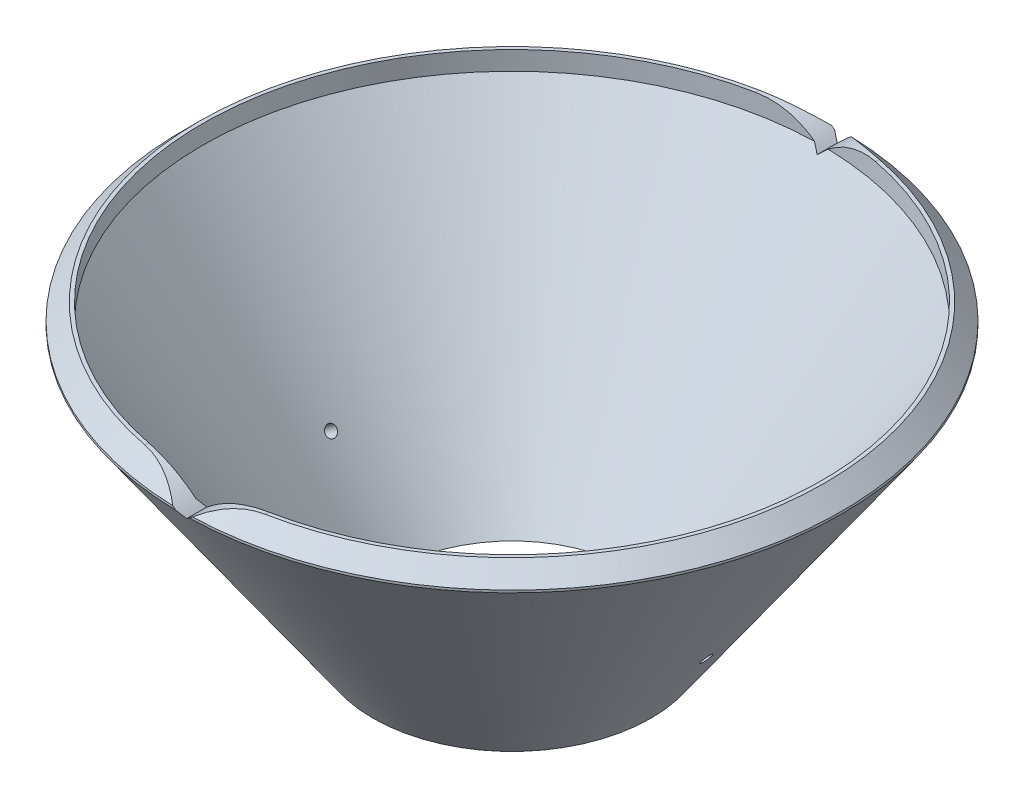
from build123d import *

# Parameters (mm, degrees)
SKETCH36_R              = 0.6
SIDE_HOLES_DEPTH        = 2
CIRPATTERN2_COUNT       = 2
SKETCH37_R              = 35
SKETCH37_R_2            = 32.86364447
BOSS_EXTRUDE1_DEPTH     = 2
CHAMFER2_SIZE           = 1.75
CUT_EXTRUDE1_DEPTH      = 59.348970142
CUT_EXTRUDE1_DEPTH_BACK = 59.348970142


with BuildPart() as part:
    # Sketch35 → Revolve1 (revolve)
    with BuildSketch(Plane.XY, mode=Mode.PRIVATE) as revolve1_sk:
        Polygon((32.86364447, 28.896639018), (12.63, 0), (14.76635553, 0), (35, 28.896639018), align=None)
    revolve(revolve1_sk.sketch.rotate(Axis((0, 28.896639018, 0), (0, -1, 0)), 90), axis=Axis((0, 28.896639018, 0), (0, -1, 0)))

    # Sketch36 → side-holes (cut, symmetric)
    with BuildSketch(Plane(origin=(8.474857205, -5.9341589, 0), x_dir=(0, 0, 1), z_dir=(-0.8191520442889934, 0.5735764363510439, 0))):
        with Locations(Location((0, 18.744270391, 0), (0, 0, 235.340174101))):
            Circle(SKETCH36_R)
    side_holes = extrude(amount=SIDE_HOLES_DEPTH, both=True, mode=Mode.SUBTRACT)

    # CirPattern2: side-holes ×2 about axis
    cirpattern2_axis = Axis((0, 0, 0), (0, 1, 0))
    for i in range(1, CIRPATTERN2_COUNT):
        add(side_holes.rotate(cirpattern2_axis, i * 360 / CIRPATTERN2_COUNT), mode=Mode.SUBTRACT)

    # Sketch37 → Boss-Extrude1 (add)
    with BuildSketch(Plane(origin=(0, 28.896639018, 0), x_dir=(1, 0, 0), z_dir=(0, 1, 0))):
        with Locations(Location((0, 0, 0), (0, 0, 270))):
            Circle(SKETCH37_R)
        with Locations(Location((0, 0, 0), (0, 0, 270))):
            Circle(SKETCH37_R_2, mode=Mode.SUBTRACT)
    extrude(amount=BOSS_EXTRUDE1_DEPTH)

    # Chamfer2
    chamfer2_edges = [part.edges().sort_by_distance(p)[0] for p in [
        (0, 30.896639018, -35),
    ]]
    chamfer(chamfer2_edges, length=CHAMFER2_SIZE)

    # Sketch38 → Cut-Extrude1 (cut, two sides: drawn at the far end of the back side and taken through both)
    with BuildSketch(Plane.XY.offset(-CUT_EXTRUDE1_DEPTH_BACK)):
        with BuildLine():
            Line((-0.013961031, 28.260600049), (0, 28.246639018))
            Line((0, 28.246639018), (0.013961031, 28.260600049))
            ThreePointArc((0.013961031, 28.260600049), (2.93377117, 30.211554811), (6.377922061, 30.896639018))
            Line((6.377922061, 30.896639018), (-6.377922061, 30.896639018))
            ThreePointArc((-6.377922061, 30.896639018), (-2.93377117, 30.211554811), (-0.013961031, 28.260600049))
        make_face()
    extrude(amount=CUT_EXTRUDE1_DEPTH + CUT_EXTRUDE1_DEPTH_BACK, mode=Mode.SUBTRACT)


solid = part.part
